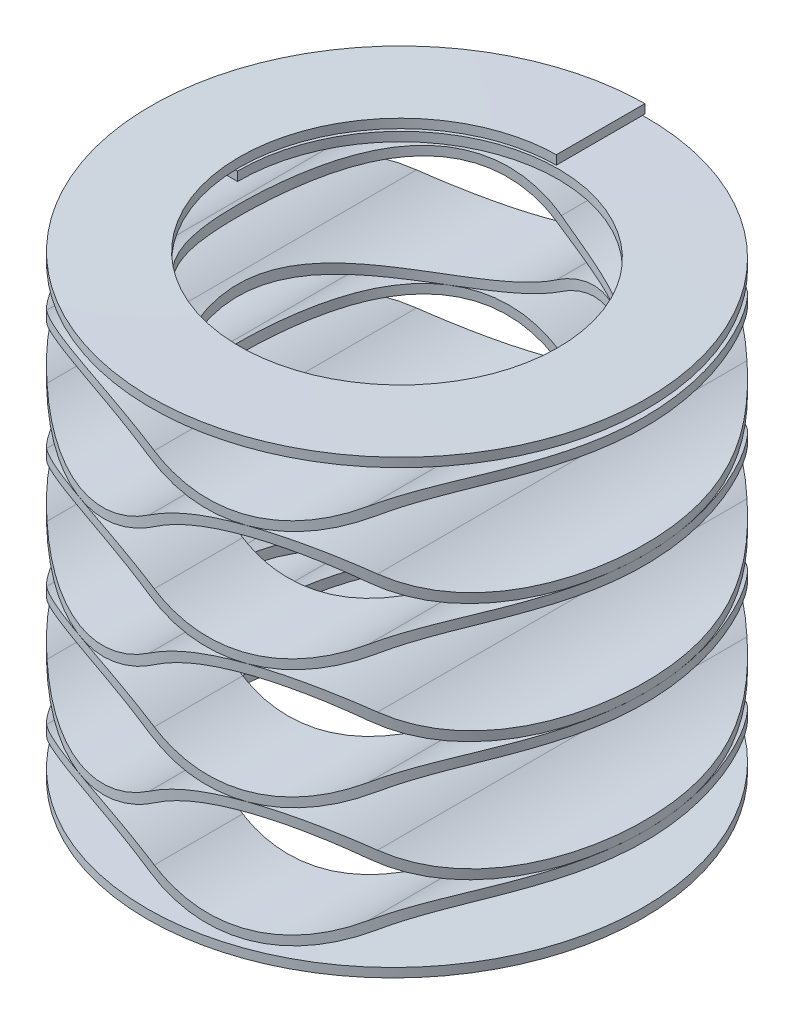
from build123d import *

# Parameters (mm, degrees)
SURFACE_EXTRUDE1_2_BACK  = 5.5499
SURFACE_EXTRUDE1_2_DEPTH = 11.0998
SURFACE_EXTRUDE1_3_BACK  = 5.5499
SURFACE_EXTRUDE1_3_DEPTH = 11.0998
SURFACE_EXTRUDE1_5_BACK  = 5.5499
SURFACE_EXTRUDE1_5_DEPTH = 11.0998
THICKEN1_T1              = 0.2032
LPATTERN1_COUNT          = 5
LPATTERN1_PITCH          = 2.677885714
CUT_EXTRUDE1_DEPTH       = 12.719523324
CUT_EXTRUDE1_DEPTH_BACK  = 12.719523324
SKETCH4_OUTSIDE_W        = 17.226
SKETCH4_OUTSIDE_H        = 17.226
SKETCH4_OUTSIDE_R        = 5.5499
CUT_EXTRUDE2_DEPTH       = 12.719523494
CUT_EXTRUDE2_DEPTH_BACK  = 12.719523494
SKETCH5_R                = 3.5687
CUT_EXTRUDE3_DEPTH       = 12.719523494
CUT_EXTRUDE3_DEPTH_BACK  = 12.719523494
SKETCH6_OUTSIDE_W        = 17.226
SKETCH6_OUTSIDE_H        = 19.515
SKETCH6_OUTSIDE_W_2      = 11.0998
SKETCH6_OUTSIDE_H_2      = 9.3726
SWEEP1_PITCH             = 0.254
SWEEP1_HEIGHT            = 0.3175
SWEEP1_RADIUS            = 4.5593
SWEEP1_START_ANGLE       = -90
SKETCH8_W                = 1.9812
SKETCH8_H                = 0.2032


with BuildPart() as body_1:
    # Surface-Extrude1: a surface, the sketch's curves swept straight by 11.0998 mm
    with BuildLine(Plane.XY.offset(-SURFACE_EXTRUDE1_2_BACK), mode=Mode.PRIVATE) as surface_extrude1_2_path:
        ThreePointArc((-5.5499, -4.6863), (-4.582318656, -4.541136718), (-3.699933333, -4.118428571))
        ThreePointArc((-3.699933333, -4.118428571), (-2.81754801, -3.695720425), (-1.849966667, -3.550557143))
    surface_extrude1_2 = Shell.extrude(surface_extrude1_2_path.wire(), (0 * SURFACE_EXTRUDE1_2_DEPTH, 0 * SURFACE_EXTRUDE1_2_DEPTH, 1 * SURFACE_EXTRUDE1_2_DEPTH))
    # Surface-Extrude1: a surface, the sketch's curves swept straight by 11.0998 mm
    with BuildLine(Plane.XY.offset(-SURFACE_EXTRUDE1_3_BACK), mode=Mode.PRIVATE) as surface_extrude1_3_path:
        ThreePointArc((-5.5499, -4.6863), (-4.582318656, -4.541136718), (-3.699933333, -4.118428571))
        ThreePointArc((-3.699933333, -4.118428571), (-2.81754801, -3.695720425), (-1.849966667, -3.550557143))
    surface_extrude1_3 = Shell.extrude(surface_extrude1_3_path.wire(), (0 * SURFACE_EXTRUDE1_3_DEPTH, 0 * SURFACE_EXTRUDE1_3_DEPTH, 1 * SURFACE_EXTRUDE1_3_DEPTH))
    # Mirror1: that surface mirrored
    mirror1_4 = surface_extrude1_3.mirror(Plane(origin=(-1.849966667, 0, 0), x_dir=(0, 0, 1), z_dir=(1, 0, 0)))
    # Surface-Extrude1: a surface, the sketch's curves swept straight by 11.0998 mm
    with BuildLine(Plane.XY.offset(-SURFACE_EXTRUDE1_5_BACK), mode=Mode.PRIVATE) as surface_extrude1_5_path:
        ThreePointArc((-5.5499, -4.6863), (-4.582318656, -4.541136718), (-3.699933333, -4.118428571))
        ThreePointArc((-3.699933333, -4.118428571), (-2.81754801, -3.695720425), (-1.849966667, -3.550557143))
    surface_extrude1_5 = Shell.extrude(surface_extrude1_5_path.wire(), (0 * SURFACE_EXTRUDE1_5_DEPTH, 0 * SURFACE_EXTRUDE1_5_DEPTH, 1 * SURFACE_EXTRUDE1_5_DEPTH))
    # Mirror1: that surface mirrored
    mirror1_6 = surface_extrude1_5.mirror(Plane(origin=(-1.849966667, 0, 0), x_dir=(0, 0, 1), z_dir=(1, 0, 0)))
    # Mirror2: that surface mirrored
    mirror2_7 = mirror1_6.mirror(Plane(origin=(1.849966667, 0, 0), x_dir=(0, 0, 1), z_dir=(1, 0, 0)))
    # Surface-Knit1: the surfaces knitted into one
    surface_knit1_1 = Shell(Face.sew_faces(surface_extrude1_2.faces() + mirror1_4.faces() + mirror2_7.faces())[0])
    add(Solid.thicken(surface_knit1_1, THICKEN1_T1))


with BuildPart() as body_2:
    # Mirror3: mirrored copy
    add(body_1.part.mirror(Plane.ZX.offset(-3.347357143)))


with BuildPart() as lpattern1_1:
    # LPattern1: pattern copy
    add(body_1.part.moved(Location(Vector(0, 1, 0) * (1 * LPATTERN1_PITCH))))


with BuildPart() as lpattern1_2:
    # LPattern1: pattern copy
    add(body_1.part.moved(Location(Vector(0, 1, 0) * (2 * LPATTERN1_PITCH))))


with BuildPart() as lpattern1_3:
    # LPattern1: pattern copy
    add(body_1.part.moved(Location(Vector(0, 1, 0) * (3 * LPATTERN1_PITCH))))


with BuildPart() as lpattern1_4:
    # LPattern1: pattern copy
    add(body_1.part.moved(Location(Vector(0, 1, 0) * (4 * LPATTERN1_PITCH))))


with BuildPart() as lpattern1_5:
    # LPattern1: pattern copy
    add(body_2.part.moved(Location(Vector(0, 1, 0) * (1 * LPATTERN1_PITCH))))


with BuildPart() as lpattern1_6:
    # LPattern1: pattern copy
    add(body_2.part.moved(Location(Vector(0, 1, 0) * (2 * LPATTERN1_PITCH))))


with BuildPart() as lpattern1_7:
    # LPattern1: pattern copy
    add(body_2.part.moved(Location(Vector(0, 1, 0) * (3 * LPATTERN1_PITCH))))


with BuildPart() as lpattern1_8:
    # LPattern1: pattern copy
    add(body_2.part.moved(Location(Vector(0, 1, 0) * (4 * LPATTERN1_PITCH))))


with BuildPart() as cut_extrude1_tool:
    # Sketch4 outside → Cut-Extrude1 (new, two sides: drawn at the far end of the back side and taken through both)
    with BuildSketch(Plane(origin=(0, 0, 0), x_dir=(1, 0, 0), z_dir=(0, 1, 0)).offset(-CUT_EXTRUDE1_DEPTH_BACK)):
        Rectangle(SKETCH4_OUTSIDE_W, SKETCH4_OUTSIDE_H)
        with Locations(Location((0, 0, 0), (0, 0, 270))):
            Circle(SKETCH4_OUTSIDE_R, mode=Mode.SUBTRACT)
    extrude(amount=CUT_EXTRUDE1_DEPTH + CUT_EXTRUDE1_DEPTH_BACK)


with BuildPart() as body_1_1:
    add(body_1.part)

    # Cut-Extrude1: cut by cut_extrude1_tool
    add(cut_extrude1_tool.part, mode=Mode.SUBTRACT)


with BuildPart() as body_2_1:
    add(body_2.part)

    # Cut-Extrude1: cut by cut_extrude1_tool
    add(cut_extrude1_tool.part, mode=Mode.SUBTRACT)


with BuildPart() as lpattern1_1_1:
    add(lpattern1_1.part)

    # Cut-Extrude1: cut by cut_extrude1_tool
    add(cut_extrude1_tool.part, mode=Mode.SUBTRACT)


with BuildPart() as lpattern1_2_1:
    add(lpattern1_2.part)

    # Cut-Extrude1: cut by cut_extrude1_tool
    add(cut_extrude1_tool.part, mode=Mode.SUBTRACT)


with BuildPart() as lpattern1_3_1:
    add(lpattern1_3.part)

    # Cut-Extrude1: cut by cut_extrude1_tool
    add(cut_extrude1_tool.part, mode=Mode.SUBTRACT)


with BuildPart() as lpattern1_4_1:
    add(lpattern1_4.part)

    # Cut-Extrude1: cut by cut_extrude1_tool
    add(cut_extrude1_tool.part, mode=Mode.SUBTRACT)


with BuildPart() as lpattern1_5_1:
    add(lpattern1_5.part)

    # Cut-Extrude1: cut by cut_extrude1_tool
    add(cut_extrude1_tool.part, mode=Mode.SUBTRACT)


with BuildPart() as lpattern1_6_1:
    add(lpattern1_6.part)

    # Cut-Extrude1: cut by cut_extrude1_tool
    add(cut_extrude1_tool.part, mode=Mode.SUBTRACT)


with BuildPart() as lpattern1_7_1:
    add(lpattern1_7.part)

    # Cut-Extrude1: cut by cut_extrude1_tool
    add(cut_extrude1_tool.part, mode=Mode.SUBTRACT)


with BuildPart() as lpattern1_8_1:
    add(lpattern1_8.part)

    # Cut-Extrude1: cut by cut_extrude1_tool
    add(cut_extrude1_tool.part, mode=Mode.SUBTRACT)


with BuildPart() as cut_extrude2_tool:
    # Sketch5 → Cut-Extrude2 (new, two sides: drawn at the far end of the back side and taken through both)
    with BuildSketch(Plane(origin=(0, 0, 0), x_dir=(1, 0, 0), z_dir=(0, 1, 0)).offset(-CUT_EXTRUDE2_DEPTH_BACK)):
        with Locations(Location((0, 0, 0), (0, 0, 270))):
            Circle(SKETCH5_R)
    extrude(amount=CUT_EXTRUDE2_DEPTH + CUT_EXTRUDE2_DEPTH_BACK)


with BuildPart() as body_1_2:
    add(body_1_1.part)

    # Cut-Extrude2: cut by cut_extrude2_tool
    add(cut_extrude2_tool.part, mode=Mode.SUBTRACT)


with BuildPart() as body_2_2:
    add(body_2_1.part)

    # Cut-Extrude2: cut by cut_extrude2_tool
    add(cut_extrude2_tool.part, mode=Mode.SUBTRACT)


with BuildPart() as lpattern1_1_2:
    add(lpattern1_1_1.part)

    # Cut-Extrude2: cut by cut_extrude2_tool
    add(cut_extrude2_tool.part, mode=Mode.SUBTRACT)


with BuildPart() as lpattern1_2_2:
    add(lpattern1_2_1.part)

    # Cut-Extrude2: cut by cut_extrude2_tool
    add(cut_extrude2_tool.part, mode=Mode.SUBTRACT)


with BuildPart() as lpattern1_3_2:
    add(lpattern1_3_1.part)

    # Cut-Extrude2: cut by cut_extrude2_tool
    add(cut_extrude2_tool.part, mode=Mode.SUBTRACT)


with BuildPart() as lpattern1_4_2:
    add(lpattern1_4_1.part)

    # Cut-Extrude2: cut by cut_extrude2_tool
    add(cut_extrude2_tool.part, mode=Mode.SUBTRACT)


with BuildPart() as lpattern1_5_2:
    add(lpattern1_5_1.part)

    # Cut-Extrude2: cut by cut_extrude2_tool
    add(cut_extrude2_tool.part, mode=Mode.SUBTRACT)


with BuildPart() as lpattern1_6_2:
    add(lpattern1_6_1.part)

    # Cut-Extrude2: cut by cut_extrude2_tool
    add(cut_extrude2_tool.part, mode=Mode.SUBTRACT)


with BuildPart() as lpattern1_7_2:
    add(lpattern1_7_1.part)

    # Cut-Extrude2: cut by cut_extrude2_tool
    add(cut_extrude2_tool.part, mode=Mode.SUBTRACT)


with BuildPart() as lpattern1_8_2:
    add(lpattern1_8_1.part)

    # Cut-Extrude2: cut by cut_extrude2_tool
    add(cut_extrude2_tool.part, mode=Mode.SUBTRACT)


with BuildPart() as cut_extrude3_tool:
    # Sketch6 outside → Cut-Extrude3 (new, two sides: drawn at the far end of the back side and taken through both)
    with BuildSketch(Plane.XY.offset(-CUT_EXTRUDE3_DEPTH_BACK)):
        with Locations((0, 2.0085)):
            Rectangle(SKETCH6_OUTSIDE_W, SKETCH6_OUTSIDE_H)
        Rectangle(SKETCH6_OUTSIDE_W_2, SKETCH6_OUTSIDE_H_2, mode=Mode.SUBTRACT)
    extrude(amount=CUT_EXTRUDE3_DEPTH + CUT_EXTRUDE3_DEPTH_BACK)


with BuildPart() as lpattern1_4_3:
    add(lpattern1_4_2.part)

    # Cut-Extrude3: cut by cut_extrude3_tool
    add(cut_extrude3_tool.part, mode=Mode.SUBTRACT)


with BuildPart() as lpattern1_7_3:
    add(lpattern1_7_2.part)

    # Cut-Extrude3: cut by cut_extrude3_tool
    add(cut_extrude3_tool.part, mode=Mode.SUBTRACT)


with BuildPart() as lpattern1_8_3:
    add(lpattern1_8_2.part)

    # Cut-Extrude3: cut by cut_extrude3_tool
    add(cut_extrude3_tool.part, mode=Mode.SUBTRACT)


with BuildPart() as body_8:
    # Sweep1: sweep along a helix
    with BuildLine() as sweep1_path:
        add(Helix(SWEEP1_PITCH, SWEEP1_HEIGHT, SWEEP1_RADIUS, center=(0, -4.7879, 0), direction=(0, -1, 0), mode=Mode.PRIVATE).rotate(Axis((0, -4.7879, 0), (0, -1, 0)), SWEEP1_START_ANGLE))
    # Sketch8 → Sweep1 (sweep)
    with BuildSketch(Plane.XY):
        with Locations((-4.5593, -4.7879)):
            Rectangle(SKETCH8_W, SKETCH8_H)
    sweep(path=sweep1_path.line, is_frenet=True)


with BuildPart() as body_9:
    # Mirror4: mirrored copy
    add(body_8.part.mirror(Plane.ZX))


solid = Compound([body_1_2.part, body_2_2.part, lpattern1_1_2.part, lpattern1_2_2.part, lpattern1_3_2.part, lpattern1_5_2.part, lpattern1_6_2.part, body_8.part, body_9.part])
